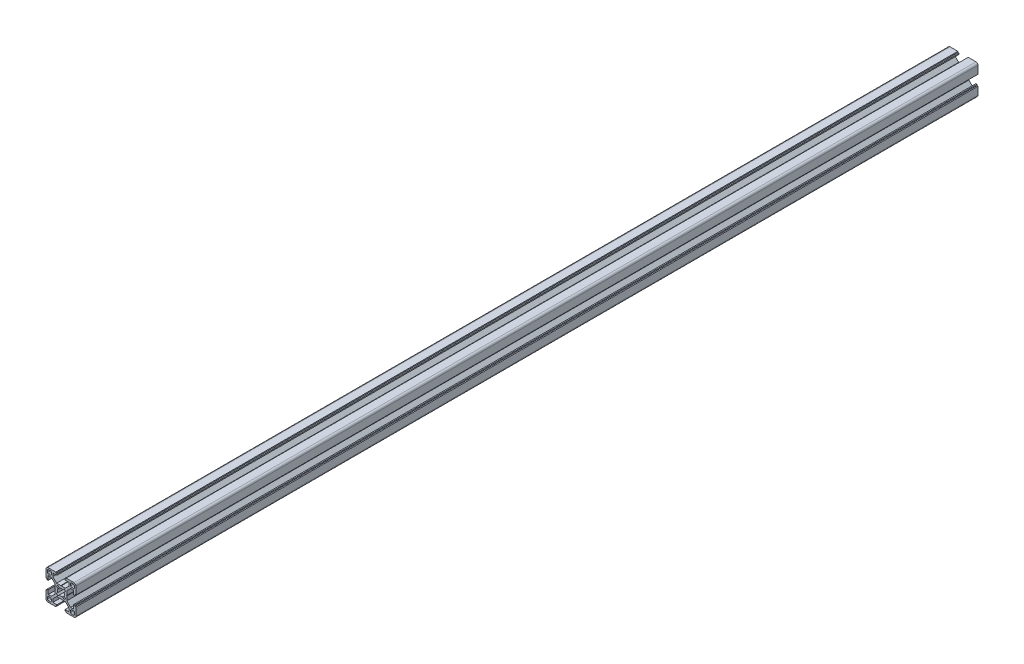
from build123d import *

# Parameters (mm, degrees)
BOSS_EXTRUDE1_DEPTH = 452


with BuildPart() as part:
    # Sketch1 → Boss-Extrude1 (new, symmetric)
    with BuildSketch(Plane.XY):
        with BuildLine():
            Line((0, -5.55), (0.25, -5.8))
            Line((0.25, -5.8), (4.385786438, -5.8))
            Line((4.385786438, -5.8), (8.2, -9.614213562))
            Line((8.2, -9.614213562), (8.2, -12.8))
            Line((8.2, -12.8), (4.1, -12.8))
            Line((4.1, -12.8), (4.1, -13.9))
            Line((4.1, -13.9), (5.2, -13.9))
            Line((5.2, -13.9), (5.2, -15))
            Line((5.2, -15), (13, -15))
            ThreePointArc((13, -15), (14.414213562, -14.414213562), (15, -13))
            Line((15, -13), (15, -5.2))
            Line((15, -5.2), (13.9, -5.2))
            Line((13.9, -5.2), (13.9, -4.1))
            Line((13.9, -4.1), (12.8, -4.1))
            Line((12.8, -4.1), (12.8, -8.2))
            Line((12.8, -8.2), (9.614213562, -8.2))
            Line((9.614213562, -8.2), (5.8, -4.385786438))
            Line((5.8, -4.385786438), (5.8, -0.25))
            Line((5.8, -0.25), (5.55, 0))
            Line((5.55, 0), (5.8, 0.25))
            Line((5.8, 0.25), (5.8, 4.385786438))
            Line((5.8, 4.385786438), (9.614213562, 8.2))
            Line((9.614213562, 8.2), (12.8, 8.2))
            Line((12.8, 8.2), (12.8, 4.1))
            Line((12.8, 4.1), (13.9, 4.1))
            Line((13.9, 4.1), (13.9, 5.2))
            Line((13.9, 5.2), (15, 5.2))
            Line((15, 5.2), (15, 13))
            ThreePointArc((15, 13), (14.414213562, 14.414213562), (13, 15))
            Line((13, 15), (5.2, 15))
            Line((5.2, 15), (5.2, 13.9))
            Line((5.2, 13.9), (4.1, 13.9))
            Line((4.1, 13.9), (4.1, 12.8))
            Line((4.1, 12.8), (8.2, 12.8))
            Line((8.2, 12.8), (8.2, 9.614213562))
            Line((8.2, 9.614213562), (4.385786438, 5.8))
            Line((4.385786438, 5.8), (0.25, 5.8))
            Line((0.25, 5.8), (0, 5.55))
            Line((0, 5.55), (-0.25, 5.8))
            Line((-0.25, 5.8), (-4.385786438, 5.8))
            Line((-4.385786438, 5.8), (-8.2, 9.614213562))
            Line((-8.2, 9.614213562), (-8.2, 12.8))
            Line((-8.2, 12.8), (-4.1, 12.8))
            Line((-4.1, 12.8), (-4.1, 13.9))
            Line((-4.1, 13.9), (-5.2, 13.9))
            Line((-5.2, 13.9), (-5.2, 15))
            Line((-5.2, 15), (-13, 15))
            ThreePointArc((-13, 15), (-14.414213562, 14.414213562), (-15, 13))
            Line((-15, 13), (-15, 5.2))
            Line((-15, 5.2), (-13.9, 5.2))
            Line((-13.9, 5.2), (-13.9, 4.1))
            Line((-13.9, 4.1), (-12.8, 4.1))
            Line((-12.8, 4.1), (-12.8, 8.2))
            Line((-12.8, 8.2), (-9.614213562, 8.2))
            Line((-9.614213562, 8.2), (-5.8, 4.385786438))
            Line((-5.8, 4.385786438), (-5.8, 0.25))
            Line((-5.8, 0.25), (-5.55, 0))
            Line((-5.55, 0), (-5.8, -0.25))
            Line((-5.8, -0.25), (-5.8, -4.385786438))
            Line((-5.8, -4.385786438), (-9.614213562, -8.2))
            Line((-9.614213562, -8.2), (-12.8, -8.2))
            Line((-12.8, -8.2), (-12.8, -4.1))
            Line((-12.8, -4.1), (-13.9, -4.1))
            Line((-13.9, -4.1), (-13.9, -5.2))
            Line((-13.9, -5.2), (-15, -5.2))
            Line((-15, -5.2), (-15, -13))
            ThreePointArc((-15, -13), (-14.414213562, -14.414213562), (-13, -15))
            Line((-13, -15), (-5.2, -15))
            Line((-5.2, -15), (-5.2, -13.9))
            Line((-5.2, -13.9), (-4.1, -13.9))
            Line((-4.1, -13.9), (-4.1, -12.8))
            Line((-4.1, -12.8), (-8.2, -12.8))
            Line((-8.2, -12.8), (-8.2, -9.614213562))
            Line((-8.2, -9.614213562), (-4.385786438, -5.8))
            Line((-4.385786438, -5.8), (-0.25, -5.8))
            Line((-0.25, -5.8), (0, -5.55))
        make_face()
        with BuildLine():
            Line((-13.5, 10.7), (-13.5, 12.5))
            ThreePointArc((-13.5, 12.5), (-13.207106781, 13.207106781), (-12.5, 13.5))
            Line((-12.5, 13.5), (-10.7, 13.5))
            ThreePointArc((-10.7, 13.5), (-9.992893219, 13.207106781), (-9.7, 12.5))
            Line((-9.7, 12.5), (-9.7, 10.7))
            ThreePointArc((-9.7, 10.7), (-9.992893219, 9.992893219), (-10.7, 9.7))
            Line((-10.7, 9.7), (-12.5, 9.7))
            ThreePointArc((-12.5, 9.7), (-13.207106781, 9.992893219), (-13.5, 10.7))
        make_face(mode=Mode.SUBTRACT)
        with BuildLine():
            Line((-13.5, -12.5), (-13.5, -10.7))
            ThreePointArc((-13.5, -10.7), (-13.207106781, -9.992893219), (-12.5, -9.7))
            Line((-12.5, -9.7), (-10.7, -9.7))
            ThreePointArc((-10.7, -9.7), (-9.992893219, -9.992893219), (-9.7, -10.7))
            Line((-9.7, -10.7), (-9.7, -12.5))
            ThreePointArc((-9.7, -12.5), (-9.992893219, -13.207106781), (-10.7, -13.5))
            Line((-10.7, -13.5), (-12.5, -13.5))
            ThreePointArc((-12.5, -13.5), (-13.207106781, -13.207106781), (-13.5, -12.5))
        make_face(mode=Mode.SUBTRACT)
        with BuildLine():
            Line((13.5, -10.7), (13.5, -12.5))
            ThreePointArc((13.5, -12.5), (13.207106781, -13.207106781), (12.5, -13.5))
            Line((12.5, -13.5), (10.7, -13.5))
            ThreePointArc((10.7, -13.5), (9.992893219, -13.207106781), (9.7, -12.5))
            Line((9.7, -12.5), (9.7, -10.7))
            ThreePointArc((9.7, -10.7), (9.992893219, -9.992893219), (10.7, -9.7))
            Line((10.7, -9.7), (12.5, -9.7))
            ThreePointArc((12.5, -9.7), (13.207106781, -9.992893219), (13.5, -10.7))
        make_face(mode=Mode.SUBTRACT)
        with BuildLine():
            Line((13.5, 12.5), (13.5, 10.7))
            ThreePointArc((13.5, 10.7), (13.207106781, 9.992893219), (12.5, 9.7))
            Line((12.5, 9.7), (10.7, 9.7))
            ThreePointArc((10.7, 9.7), (9.992893219, 9.992893219), (9.7, 10.7))
            Line((9.7, 10.7), (9.7, 12.5))
            ThreePointArc((9.7, 12.5), (9.992893219, 13.207106781), (10.7, 13.5))
            Line((10.7, 13.5), (12.5, 13.5))
            ThreePointArc((12.5, 13.5), (13.207106781, 13.207106781), (13.5, 12.5))
        make_face(mode=Mode.SUBTRACT)
        with BuildLine():
            Line((-1.590718277, -3.00493184), (-3.181708535, -4.595922097))
            Line((-3.181708535, -4.595922097), (-4.595922097, -3.181708535))
            Line((-4.595922097, -3.181708535), (-3.00493184, -1.590718277))
            ThreePointArc((-3.00493184, -1.590718277), (-3.4, 0), (-3.00493184, 1.590718277))
            Line((-3.00493184, 1.590718277), (-4.595922097, 3.181708535))
            Line((-4.595922097, 3.181708535), (-3.181708535, 4.595922097))
            Line((-3.181708535, 4.595922097), (-1.590718277, 3.00493184))
            ThreePointArc((-1.590718277, 3.00493184), (0, 3.4), (1.590718277, 3.00493184))
            Line((1.590718277, 3.00493184), (3.181708535, 4.595922097))
            Line((3.181708535, 4.595922097), (4.595922097, 3.181708535))
            Line((4.595922097, 3.181708535), (3.00493184, 1.590718277))
            ThreePointArc((3.00493184, 1.590718277), (3.4, 0), (3.00493184, -1.590718277))
            Line((3.00493184, -1.590718277), (4.595922097, -3.181708535))
            Line((4.595922097, -3.181708535), (3.181708535, -4.595922097))
            Line((3.181708535, -4.595922097), (1.590718277, -3.00493184))
            ThreePointArc((1.590718277, -3.00493184), (0, -3.4), (-1.590718277, -3.00493184))
        make_face(mode=Mode.SUBTRACT)
    extrude(amount=BOSS_EXTRUDE1_DEPTH, both=True)


solid = part.part
